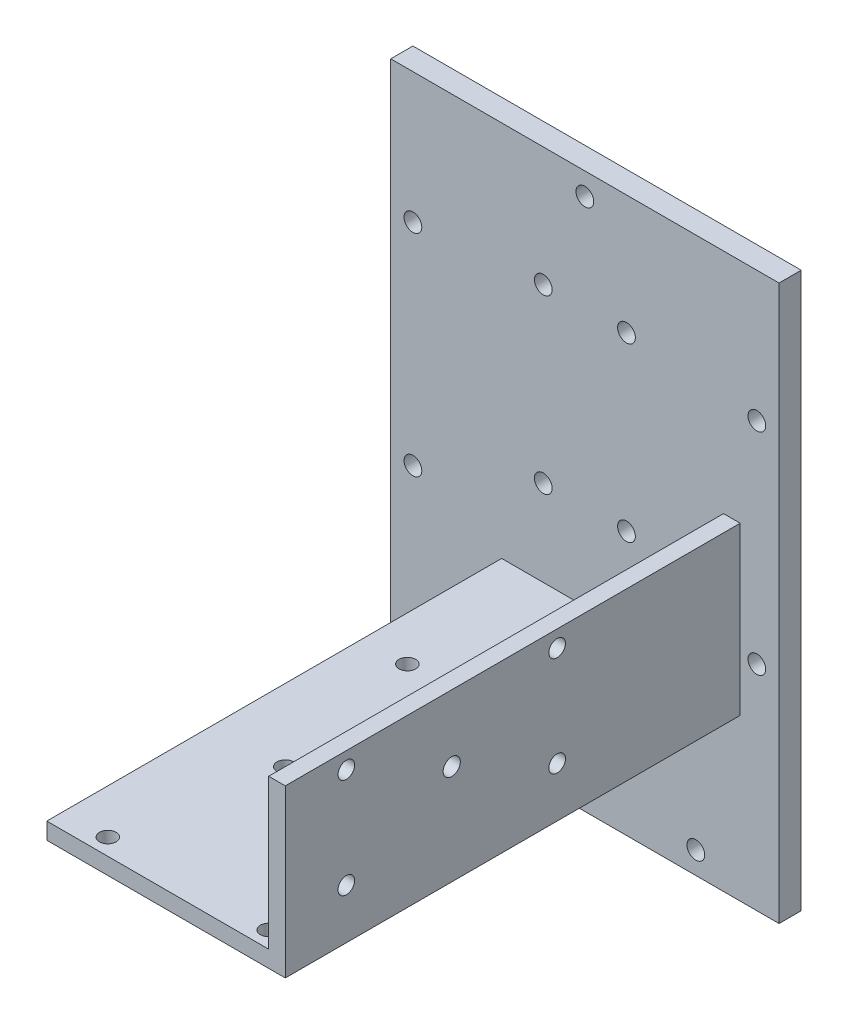
from build123d import *

# Parameters (mm, degrees)
SKETCH_1_W          = 70
SKETCH_1_H          = 100
SKETCH_1_R          = 1.6
EXTRUDE_1_DEPTH     = 4
SKETCH_2_W          = 15
SKETCH_2_H          = 3
SKETCH_2_W_2        = 25
EXTRUDE_2_DEPTH     = 82
SKETCH_3_R          = 1.5
SKETCH_3_R_2        = 1.539226355
CUT_EXTRUDE_1_DEPTH = 8
EXTRUDE_3_DEPTH     = 2
SKETCH_7_R          = 1.6
EXTRUDE_5_DEPTH     = 82
SKETCH_10_R         = 1.5
SKETCH_10_R_2       = 1.55
CUT_EXTRUDE_2_DEPTH = 118.749734607


with BuildPart() as part:
    # 草图1 → 凸台-拉伸1 (new body)
    with BuildSketch(Plane.XY):
        with Locations((3.334002404, 0)):
            Rectangle(SKETCH_1_W, SKETCH_1_H)
        with Locations((34.334002404, 26.5)):
            Circle(SKETCH_1_R, mode=Mode.SUBTRACT)
        with Locations((-16.665997596, -46)):
            Circle(SKETCH_1_R, mode=Mode.SUBTRACT)
        with Locations((3.334002404, 46)):
            Circle(SKETCH_1_R, mode=Mode.SUBTRACT)
        with Locations((10.834002404, 28.5)):
            Circle(SKETCH_1_R, mode=Mode.SUBTRACT)
        with Locations((10.834002404, -2.5)):
            Circle(SKETCH_1_R, mode=Mode.SUBTRACT)
        with Locations((34.334002404, -11.5)):
            Circle(SKETCH_1_R, mode=Mode.SUBTRACT)
        with Locations(Location((-27.665997596, 26.5, 0), (0, 0, 180))):
            Circle(SKETCH_1_R, mode=Mode.SUBTRACT)
        with Locations(Location((-4.165997596, 28.5, 0), (0, 0, 180))):
            Circle(SKETCH_1_R, mode=Mode.SUBTRACT)
        with Locations(Location((-4.165997596, -2.5, 0), (0, 0, 180))):
            Circle(SKETCH_1_R, mode=Mode.SUBTRACT)
        with Locations(Location((-27.665997596, -11.5, 0), (0, 0, 180))):
            Circle(SKETCH_1_R, mode=Mode.SUBTRACT)
        with Locations(Location((23.334002404, -46, 0), (0, 0, 180))):
            Circle(SKETCH_1_R, mode=Mode.SUBTRACT)
    extrude(amount=EXTRUDE_1_DEPTH)

    # 草图2 → 凸台-拉伸2 (add)
    with BuildSketch(Plane.XY.offset(4)):
        with Locations((-4.165997596, -19.5)):
            Rectangle(SKETCH_2_W, SKETCH_2_H)
        with Locations((15.834002404, -19.5)):
            Rectangle(SKETCH_2_W_2, SKETCH_2_H)
    extrude(amount=EXTRUDE_2_DEPTH)

    # 草图3 → 切除-拉伸1 (cut)
    with BuildSketch(Plane.XZ.offset(21)):
        with Locations(Location((-3.665997596, 83, 0), (0, 0, 270))):
            Circle(SKETCH_3_R)
        with Locations(Location((25.334002404, 83, 0), (0, 0, 90))):
            Circle(SKETCH_3_R)
        with Locations(Location((25.334002404, 29, 0), (0, 0, 270))):
            Circle(SKETCH_3_R)
        with Locations(Location((-3.665997596, 29, 0), (0, 0, 90))):
            Circle(SKETCH_3_R)
        with Locations(Location((8.334002404, 63, 0), (0, 0, 270))):
            Circle(SKETCH_3_R)
        with Locations(Location((8.334002404, 56, 0), (0, 0, 270))):
            Circle(SKETCH_3_R_2)
        with Locations(Location((15.334002404, 56, 0), (0, 0, 270))):
            Circle(SKETCH_3_R)
        with Locations(Location((8.334002404, 49, 0), (0, 0, 270))):
            Circle(SKETCH_3_R)
        with Locations(Location((1.334002404, 56, 0), (0, 0, 270))):
            Circle(SKETCH_3_R)
    extrude(amount=-CUT_EXTRUDE_1_DEPTH, mode=Mode.SUBTRACT)

    # 草图6 → 凸台-拉伸3 (add, symmetric)
    with BuildSketch(Plane.YZ.offset(8.334002404)):
        Polygon((-21, 44.617390455), (-36.570771874, 4), (-21, 4), align=None)
    extrude(amount=EXTRUDE_3_DEPTH, both=True)

    # 草图7 → 凸台-拉伸5 (add)
    with BuildSketch(Plane.XY.offset(4)):
        with Locations((34.334002404, -11.5)):
            Circle(SKETCH_7_R)
        Polygon((31.334002404, -21), (28.334002404, -21), (28.334002404, -18), (28.334002404, 9), (31.334002404, 9), align=None)
    extrude(amount=EXTRUDE_5_DEPTH)


with BuildPart() as extrude_5_kept_piece:
    # of the separate pieces the step leaves, the one the design keeps (extrude_5_pieces_kept)
    add(part.part.solids().sort_by_distance((-31.665997596, 50, 0))[0])

    # 草图10 → 切除-拉伸2 (cut, through all)
    with BuildSketch(Plane(origin=(31.334002404, 0, 0), x_dir=(0, 0, -1), z_dir=(1, 0, 0))):
        with Locations((-37, -12)):
            Circle(SKETCH_10_R)
        with Locations((-37, 6)):
            Circle(SKETCH_10_R)
        with Locations((-75, -12)):
            Circle(SKETCH_10_R)
        with Locations(Location((-75, 6, 0), (0, 0, 270))):
            Circle(SKETCH_10_R)
        with Locations((-56, -3)):
            Circle(SKETCH_10_R_2)
    extrude(amount=-CUT_EXTRUDE_2_DEPTH, mode=Mode.SUBTRACT)


solid = extrude_5_kept_piece.part
